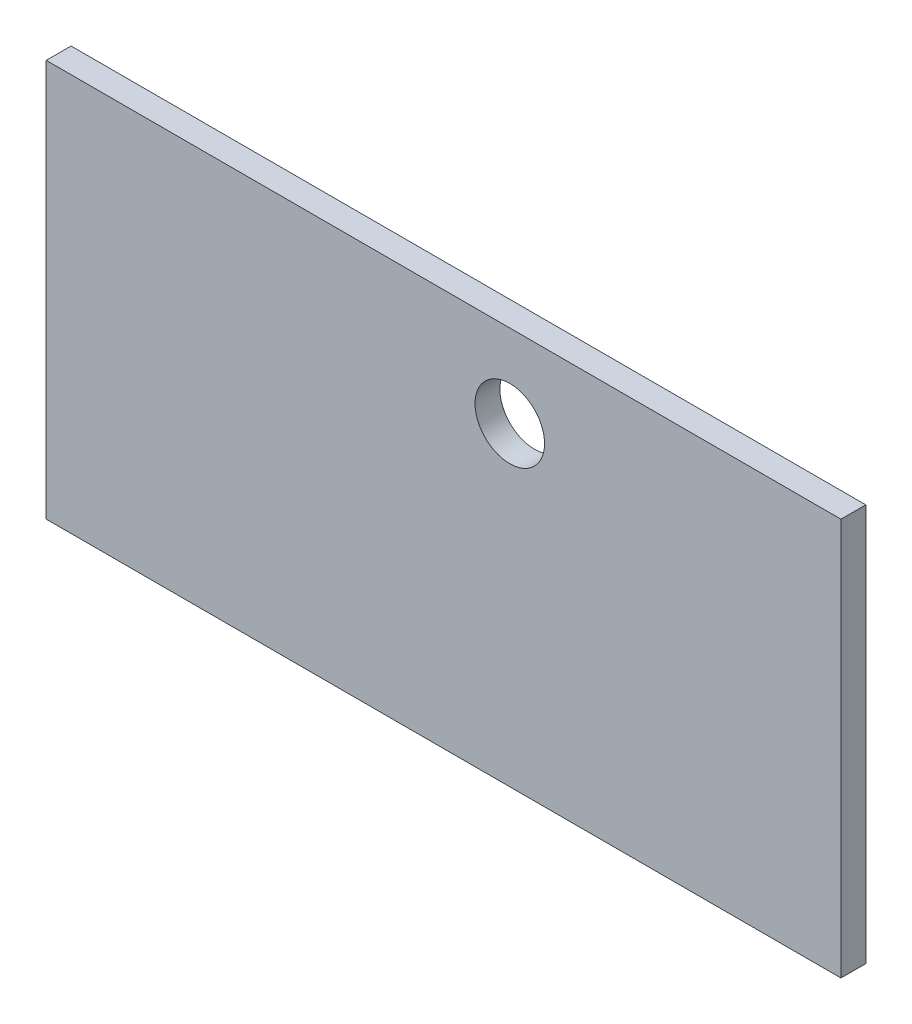
from build123d import *

# Parameters (mm, degrees)
SKETCH1_W                     = 304.8
SKETCH1_H                     = 152.4
BOSS_EXTRUDE1_DEPTH           = 9.525
SKETCH5_R                     = 13.335
CUT_EXTRUDE3_DEPTH            = 171.65440406
F_1_1_05_DIAMETER_HOLE1_D     = 26.67
F_1_1_05_DIAMETER_HOLE1_DEPTH = 60.324
F_1_1_05_DIAMETER_HOLE1_TIP   = 8.012476355
F_1_1_05_DIAMETER_HOLE2_D     = 26.67
F_1_1_05_DIAMETER_HOLE2_DEPTH = 60.324
F_1_1_05_DIAMETER_HOLE2_TIP   = 8.012476355


with BuildPart() as part:
    # Sketch1 → Boss-Extrude1 (new body)
    with BuildSketch(Plane.XY):
        Rectangle(SKETCH1_W, SKETCH1_H)
    extrude(amount=BOSS_EXTRUDE1_DEPTH)

    # Sketch5 → Cut-Extrude3 (cut, through all)
    with BuildSketch(Plane(origin=(0, 0, 0), x_dir=(-1, 0, 0), z_dir=(0, 0, -1))):
        with Locations((-25.4, 44.45)):
            Circle(SKETCH5_R)
    extrude(amount=-CUT_EXTRUDE3_DEPTH, mode=Mode.SUBTRACT)

    # 1 (1.05) Diameter Hole1
    with Locations(Plane(origin=(1137.132872188, -76.2, 69.85), x_dir=(1, 0, 0), z_dir=(0, 0, 1))):
        with Locations((-1111.732872188, 120.65)):
            Hole(F_1_1_05_DIAMETER_HOLE1_D / 2, depth=F_1_1_05_DIAMETER_HOLE1_DEPTH)
            with Locations((0, 0, -(F_1_1_05_DIAMETER_HOLE1_DEPTH + F_1_1_05_DIAMETER_HOLE1_TIP / 2))):  # 118° drill point
                Cone(0, F_1_1_05_DIAMETER_HOLE1_D / 2, F_1_1_05_DIAMETER_HOLE1_TIP, mode=Mode.SUBTRACT)

    # 1 (1.05) Diameter Hole2
    with Locations(Plane(origin=(1137.132872188, -76.2, 9.525), x_dir=(1, 0, 0), z_dir=(0, 0, 1))):
        with Locations((-1111.732872188, 120.65)):
            Hole(F_1_1_05_DIAMETER_HOLE2_D / 2, depth=F_1_1_05_DIAMETER_HOLE2_DEPTH)
            with Locations((0, 0, -(F_1_1_05_DIAMETER_HOLE2_DEPTH + F_1_1_05_DIAMETER_HOLE2_TIP / 2))):  # 118° drill point
                Cone(0, F_1_1_05_DIAMETER_HOLE2_D / 2, F_1_1_05_DIAMETER_HOLE2_TIP, mode=Mode.SUBTRACT)


solid = part.part
